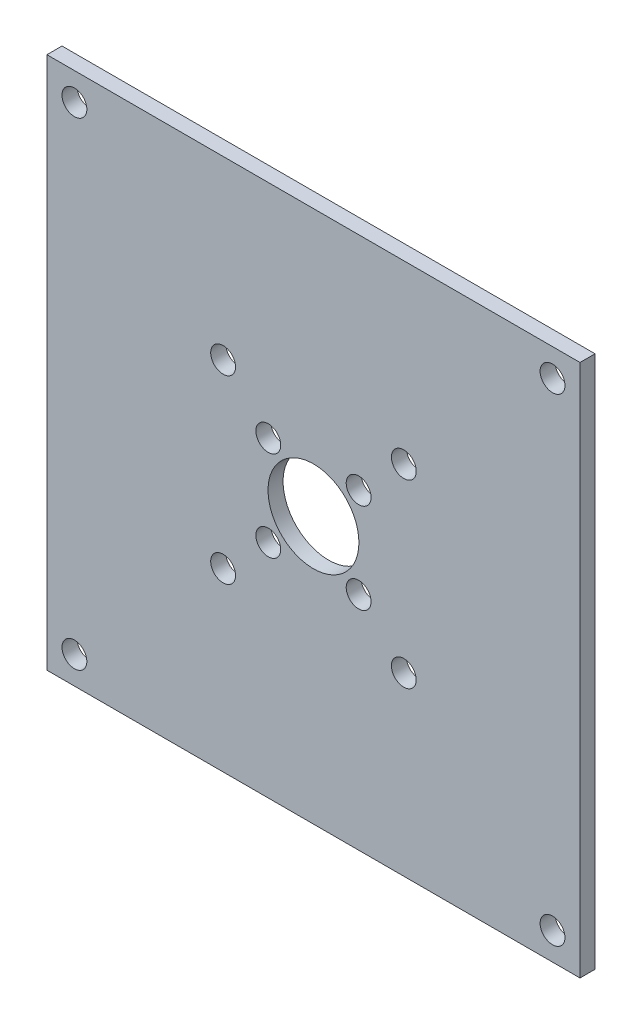
from build123d import *

# Parameters (mm, degrees)
SKETCH1_W           = 177
SKETCH1_H           = 177
SKETCH1_R           = 4.125
SKETCH1_R_2         = 15.088203436
BOSS_EXTRUDE1_DEPTH = 5


with BuildPart() as part:
    # Sketch1 → Boss-Extrude1 (new body)
    with BuildSketch(Plane.XY):
        with Locations((88.5, 88.5)):
            Rectangle(SKETCH1_W, SKETCH1_H)
        with Locations((9.125, 9.125)):
            Circle(SKETCH1_R, mode=Mode.SUBTRACT)
        with Locations((167.875, 9.125)):
            Circle(SKETCH1_R, mode=Mode.SUBTRACT)
        with Locations((167.875, 167.875)):
            Circle(SKETCH1_R, mode=Mode.SUBTRACT)
        with Locations((88.5, 88.5)):
            Circle(SKETCH1_R_2, mode=Mode.SUBTRACT)
        with Locations((9.125, 167.875)):
            Circle(SKETCH1_R, mode=Mode.SUBTRACT)
        with Locations((73.5, 73.5)):
            Circle(SKETCH1_R, mode=Mode.SUBTRACT)
        with Locations((103.5, 73.5)):
            Circle(SKETCH1_R, mode=Mode.SUBTRACT)
        with Locations((73.5, 103.5)):
            Circle(SKETCH1_R, mode=Mode.SUBTRACT)
        with Locations((103.5, 103.5)):
            Circle(SKETCH1_R, mode=Mode.SUBTRACT)
        with Locations((58.5, 58.5)):
            Circle(SKETCH1_R, mode=Mode.SUBTRACT)
        with Locations((118.5, 58.5)):
            Circle(SKETCH1_R, mode=Mode.SUBTRACT)
        with Locations((58.5, 118.5)):
            Circle(SKETCH1_R, mode=Mode.SUBTRACT)
        with Locations((118.5, 118.5)):
            Circle(SKETCH1_R, mode=Mode.SUBTRACT)
    extrude(amount=BOSS_EXTRUDE1_DEPTH)


solid = part.part
